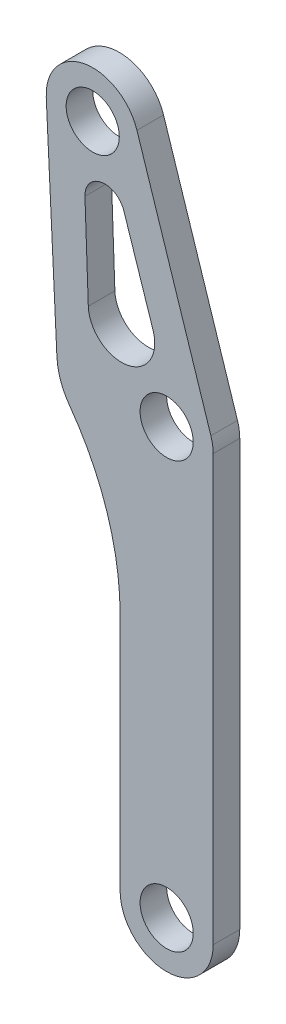
from build123d import *

# Parameters (mm, degrees)
SKETCH_1_R      = 2
EXTRUDE_2_DEPTH = 2
FILLET_1_R      = 5


with BuildPart() as part:
    # 草图1 → 凸台-拉伸2 (new body)
    with BuildSketch(Plane.XY):
        with BuildLine():
            Line((3.5, 32), (3.5, 0))
            ThreePointArc((3.5, 0), (0, -3.5), (-3.5, 0))
            Line((-3.5, 0), (-3.5, 18))
            ThreePointArc((-3.5, 18), (-4.706147584, 24.840402867), (-8.179111138, 30.855752194))
            Line((-8.179111138, 30.855752194), (-9.058182296, 48.949169661))
            ThreePointArc((-9.058182296, 48.949169661), (-6.193568214, 52.5616192), (-2.233608092, 50.200576774))
            Line((-2.233608092, 50.200576774), (3.328697807, 33.08155948))
            ThreePointArc((3.328697807, 33.08155948), (3.456909192, 32.547520628), (3.5, 32))
        make_face()
        with Locations((0, 32)):
            Circle(SKETCH_1_R, mode=Mode.SUBTRACT)
        Circle(SKETCH_1_R, mode=Mode.SUBTRACT)
        with Locations((-5.562305899, 49.119017293)):
            Circle(SKETCH_1_R, mode=Mode.SUBTRACT)
        with BuildLine():
            Line((-6.146357487, 43.946342838), (-5.894516621, 36.910571396))
            ThreePointArc((-5.894516621, 36.910571396), (-2.956230896, 34.539004156), (-1.02143743, 37.781600094))
            Line((-1.02143743, 37.781600094), (-3.222509972, 44.468960057))
            ThreePointArc((-3.222509972, 44.468960057), (-4.91124893, 45.476597506), (-6.146357487, 43.946342838))
        make_face(mode=Mode.SUBTRACT)
    extrude(amount=EXTRUDE_2_DEPTH)

    # 圆角1
    fillet_1_edges = [part.edges().sort_by_distance(p)[0] for p in [
        (-8.179111138, 30.855752194, 1),
    ]]
    fillet(fillet_1_edges, radius=FILLET_1_R)


solid = part.part
